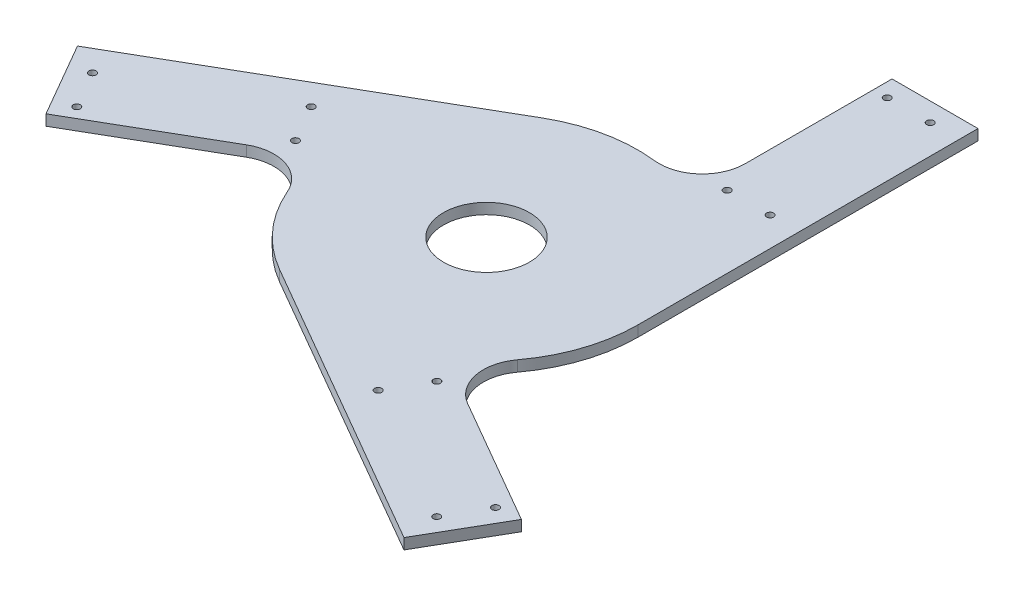
from build123d import *

# Parameters (mm, degrees)
SKETCH_2_R          = 70.51
EXTRUDE_1_DEPTH     = 5
SKETCH_3_R          = 20
CUT_EXTRUDE_1_DEPTH = 235.001208449
HOLE_WIZARD_M4_1_D  = 3.3


with BuildPart() as part:
    # 스케치2 → 보스-돌출1 (new body)
    with BuildSketch(Plane(origin=(0, 0, 0), x_dir=(1, 0, 0), z_dir=(0, 1, 0))):
        with BuildLine():
            ThreePointArc((-70.305885551, -5.361208523), (-62.360516315, 32.906323175), (-35.255, 61.063451221))
            Line((-35.255, 61.063451221), (-172.303520149, -18.061548779))
            Line((-172.303520149, -18.061548779), (-152.303520149, -52.702564931))
            Line((-152.303520149, -52.702564931), (-93.108708968, -18.52642476))
            Line((-93.108708968, -18.52642476), (-70.305885551, -5.361208523))
        make_face()
        with BuildLine():
            ThreePointArc((-64.74417268, -27.925833988), (-68.461084842, -16.874239606), (-70.305885551, -5.361208523))
            Line((-70.305885551, -5.361208523), (-93.108708968, -18.52642476))
            ThreePointArc((-93.108708968, -18.52642476), (-76.817557222, -16.862165002), (-64.74417268, -27.925833988))
        make_face()
        Circle(SKETCH_2_R)
        with BuildLine():
            Line((62.598708968, -71.371294899), (39.795885551, -58.206078662))
            ThreePointArc((39.795885551, -58.206078662), (2.682546343, -70.45895291), (-35.255, -61.063451221))
            Line((-35.255, -61.063451221), (101.793520149, -140.188451221))
            Line((101.793520149, -140.188451221), (121.793520149, -105.547435069))
            Line((121.793520149, -105.547435069), (62.598708968, -71.371294899))
        make_face()
        with BuildLine():
            ThreePointArc((62.598708968, -71.371294899), (53.011841866, -58.09487351), (56.556567996, -42.107181294))
            ThreePointArc((56.556567996, -42.107181294), (48.84406259, -50.85191884), (39.795885551, -58.206078662))
            Line((39.795885551, -58.206078662), (62.598708968, -71.371294899))
        make_face()
        with BuildLine():
            Line((30.51, 89.89771966), (30.51, 63.567287185))
            ThreePointArc((30.51, 63.567287185), (59.677969972, 37.552629735), (70.51, 0))
            Line((70.51, 0), (70.51, 158.25))
            Line((70.51, 158.25), (30.51, 158.25))
            Line((30.51, 158.25), (30.51, 89.89771966))
        make_face()
        with BuildLine():
            ThreePointArc((8.187604685, 70.033015282), (19.617022252, 67.726158447), (30.51, 63.567287185))
            Line((30.51, 63.567287185), (30.51, 89.89771966))
            ThreePointArc((30.51, 89.89771966), (23.805715357, 74.957038512), (8.187604685, 70.033015282))
        make_face()
    extrude(amount=EXTRUDE_1_DEPTH)

    # 스케치3 → 컷-돌출1 (cut, through all)
    with BuildSketch(Plane(origin=(0, 5, 0), x_dir=(1, 0, 0), z_dir=(0, 1, 0))):
        with Locations(Location((0, 0, 0), (0, 0, 270))):
            Circle(SKETCH_3_R)
    extrude(amount=-CUT_EXTRUDE_1_DEPTH, mode=Mode.SUBTRACT)

    # M4 나사 구멍1 (through all)
    with Locations(Plane(origin=(0, 5, 0), x_dir=(1, 0, 0), z_dir=(0, 1, 0))):
        with Locations((57.01, 149.5), (37.01, 75), (37.01, 149.5), (57.01, 75), (100.965797866, -124.12210827), (46.446905284, -69.551600194), (110.965797866, -106.801600194), (36.446905284, -86.87210827), (-157.975797866, -25.37789173), (-83.456905284, -5.448399806), (-147.975797866, -42.698399806), (-93.456905284, 11.87210827)):
            Hole(HOLE_WIZARD_M4_1_D / 2)


solid = part.part
